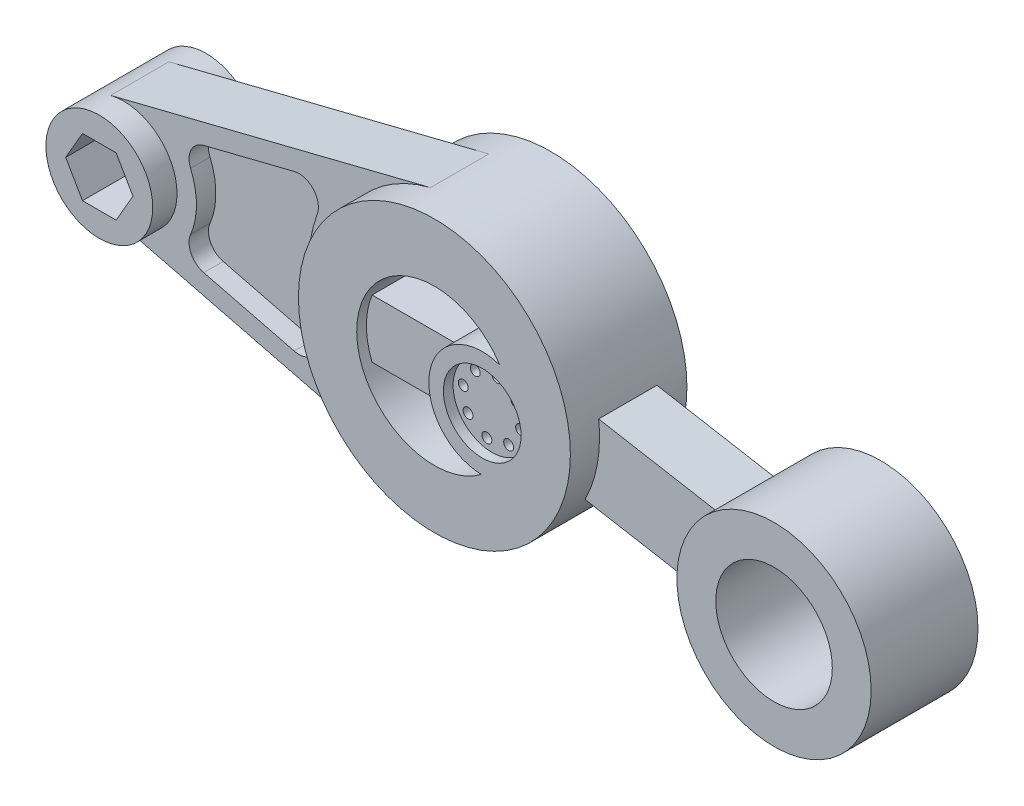
from build123d import *
from build123d.topology import SkipClean

# Parameters (mm, degrees)
LEFT_ARM_DEPTH                = 15
SKETCH2_R                     = 27.5
LEFT_BOSS_DEPTH               = 27.5
LEFT_HEX_DEPTH                = 261.672208
LEFT_HEX_DEPTH_BACK           = 261.672208
SKETCH3_R                     = 70
CENTRE_BOSS_DEPTH             = 30
SKETCH5_W                     = 30
SKETCH5_H                     = 40
RIGHT_ARM_DEPTH               = 175
SKETCH7_R                     = 50
RIGHT_BOSS_DEPTH              = 27.5
SKETCH8_R                     = 30
RIGHT_BOSS_HOLE_DEPTH         = 410.449269
SKETCH9_R                     = 40
CENTRE_HOLE_DEPTH             = 410.807825
SKETCH10_R                    = 27.5
CENTRE_BLOB_DEPTH             = 30
CENTRE_BEAM_REACH             = 240.323
SKETCH11_W                    = 50
SKETCH11_H                    = 30
CENTRE_BEAM_DIRECTION_2_REACH = 240.323
SKETCH12_R                    = 20
CUT_EXTRUDE4_DEPTH            = 5
F_1_4_20_TAPPED_HOLE1_D       = 5.1054
CIRPATTERN1_COUNT             = 8
CUT_OUT_DEPTH                 = 10
FILLET1_R                     = 10
FILLET1_OF_MIRROR2_R          = 10


with BuildPart() as part:
    # Sketch1 → LEFT_ARM (new, symmetric)
    with BuildSketch(Plane.XY):
        with BuildLine():
            Line((-6.678571, 26.676707), (158, 67.904344))
            ThreePointArc((158, 67.904344), (245, 0), (158, -67.904344))
            Line((158, -67.904344), (-6.678571, -26.676707))
            ThreePointArc((-6.678571, -26.676707), (-27.5, 0), (-6.678571, 26.676707))
        make_face()
    extrude(amount=LEFT_ARM_DEPTH, both=True)

    # Sketch2 → LEFT_Boss (add, symmetric)
    with SkipClean():  # the faces are left unmerged after this step: merging them gives an invalid solid
        with BuildSketch(Plane.XY):
            Circle(SKETCH2_R)
        extrude(amount=LEFT_BOSS_DEPTH, both=True)

    # Sketch4 → LEFT_Hex (cut, two sides: drawn at the far end of the back side and taken through both)
    with SkipClean():  # the faces are left unmerged after this step: merging them gives an invalid solid
        with BuildSketch(Plane.XY.offset(27.5).offset(-LEFT_HEX_DEPTH_BACK)):
            Polygon((17.320508, 0), (8.660254, 15), (-8.660254, 15), (-17.320508, 0), (-8.660254, -15), (8.660254, -15), align=None)
        extrude(amount=LEFT_HEX_DEPTH + LEFT_HEX_DEPTH_BACK, mode=Mode.SUBTRACT)

    # Sketch3 → CENTRE_Boss (add, symmetric)
    with BuildSketch(Plane.XY):
        with Locations((175, 0)):
            Circle(SKETCH3_R)
    extrude(amount=CENTRE_BOSS_DEPTH, both=True)

    # Sketch5 → RIGHT_ARM (add)
    with BuildSketch(Plane(origin=(169.723104, -29.926763, 0), x_dir=(0, 0, -1), z_dir=(0.984807753012208, -0.17364817766693072, 0))):
        with Locations((0, 30.388431)):
            Rectangle(SKETCH5_W, SKETCH5_H)
    extrude(amount=RIGHT_ARM_DEPTH)

    # Sketch7 → RIGHT_Boss (add, symmetric)
    with BuildSketch(Plane.XY):
        with Locations((347.341357, -30.388431)):
            Circle(SKETCH7_R)
    extrude(amount=RIGHT_BOSS_DEPTH, both=True)

    # Sketch8 → RIGHT_Boss_Hole (cut, through all)
    with BuildSketch(Plane.XY.offset(27.5)):
        with Locations((347.341357, -30.388431)):
            Circle(SKETCH8_R)
    extrude(amount=-RIGHT_BOSS_HOLE_DEPTH, mode=Mode.SUBTRACT)

    # Sketch9 → CENTRE_Hole (cut, through all)
    with BuildSketch(Plane.XY.offset(30)):
        with Locations((175, 0)):
            Circle(SKETCH9_R)
    extrude(amount=-CENTRE_HOLE_DEPTH, mode=Mode.SUBTRACT)

    # Sketch10 → CENTRE_Blob (add, symmetric)
    with BuildSketch(Plane.XY):
        with Locations((199.620194, -4.341204)):
            Circle(SKETCH10_R)
    extrude(amount=CENTRE_BLOB_DEPTH, both=True)

    # Sketch11 → CENTRE_Beam (add, up to next)
    with BuildSketch(Plane(origin=(175, 0, 0), x_dir=(0, 0, -1), z_dir=(1, 0, 0)), mode=Mode.PRIVATE) as centre_beam_sk1:
        Rectangle(SKETCH11_W, SKETCH11_H)
    centre_beam_tool1 = extrude(centre_beam_sk1.sketch, amount=CENTRE_BEAM_REACH, mode=Mode.PRIVATE) - part.part
    add(centre_beam_tool1.solids().sort_by_distance((175, 0, 0))[0])

    # Sketch11 → CENTRE_Beam direction 2 (add, up to next)
    with BuildSketch(Plane(origin=(175, 0, 0), x_dir=(0, 0, -1), z_dir=(1, 0, 0)), mode=Mode.PRIVATE) as centre_beam_direction_2_sk1:
        Rectangle(SKETCH11_W, SKETCH11_H)
    centre_beam_direction_2_tool1 = extrude(centre_beam_direction_2_sk1.sketch, amount=-CENTRE_BEAM_DIRECTION_2_REACH, mode=Mode.PRIVATE) - part.part
    add(centre_beam_direction_2_tool1.solids().sort_by_distance((175, 0, 0))[0])

    # Sketch12 → Cut-Extrude4 (cut)
    with BuildSketch(Plane.XY.offset(30)):
        with Locations((199.620194, -4.341204)):
            Circle(SKETCH12_R)
    cut_extrude4 = extrude(amount=-CUT_EXTRUDE4_DEPTH, mode=Mode.SUBTRACT)

    # 1/4-20 Tapped Hole1 (through all)
    with Locations(Plane.XY.offset(25)):
        with Locations((184.848078, -1.736482)):
            f_1_4_20_tapped_hole1 = Hole(F_1_4_20_TAPPED_HOLE1_D / 2)

    # CirPattern1: 1/4-20 Tapped Hole1 ×8 about axis
    cirpattern1_axis = Axis((199.620194, -4.341204, 0), (0, 0, 1))
    for i in range(1, CIRPATTERN1_COUNT):
        add(f_1_4_20_tapped_hole1.rotate(cirpattern1_axis, i * 360 / CIRPATTERN1_COUNT), mode=Mode.SUBTRACT)

    # Mirror1: Cut-Extrude4 across plane
    add(cut_extrude4.mirror(Plane.XY), mode=Mode.SUBTRACT)

    # Sketch15 → Cut_OUT (cut)
    with BuildSketch(Plane.XY.offset(15)):
        with BuildLine():
            Line((109.097712, 45.352932), (27.923319, 25.030746))
            ThreePointArc((27.923319, 25.030746), (37.5, 0), (27.923319, -25.030746))
            Line((27.923319, -25.030746), (109.097712, -45.352932))
            ThreePointArc((109.097712, -45.352932), (95, 0), (109.097712, 45.352932))
        make_face()
    cut_out = extrude(amount=-CUT_OUT_DEPTH, mode=Mode.SUBTRACT)

    # Fillet1
    fillet1_edges = [part.edges().sort_by_distance(p)[0] for p in [
        (27.923319, -25.030746, 10),
        (27.923319, 25.030746, 10),
        (109.097712, 45.352932, 10),
        (109.097712, -45.352932, 10),
    ]]
    fillet(fillet1_edges, radius=FILLET1_R)

    # Mirror2: Cut_OUT across plane
    with SkipClean():  # the faces are left unmerged after this step: merging them gives an invalid solid
        add(cut_out.mirror(Plane.XY), mode=Mode.SUBTRACT)

    # Fillet1 of Mirror2
    fillet1_of_mirror2_edges = [part.edges().sort_by_distance(p)[0] for p in [
        (27.923319, -25.030746, -10),
        (27.923319, 25.030746, -10),
        (109.097712, 45.352932, -10),
        (109.097712, -45.352932, -10),
    ]]
    fillet(fillet1_of_mirror2_edges, radius=FILLET1_OF_MIRROR2_R)


solid = part.part
